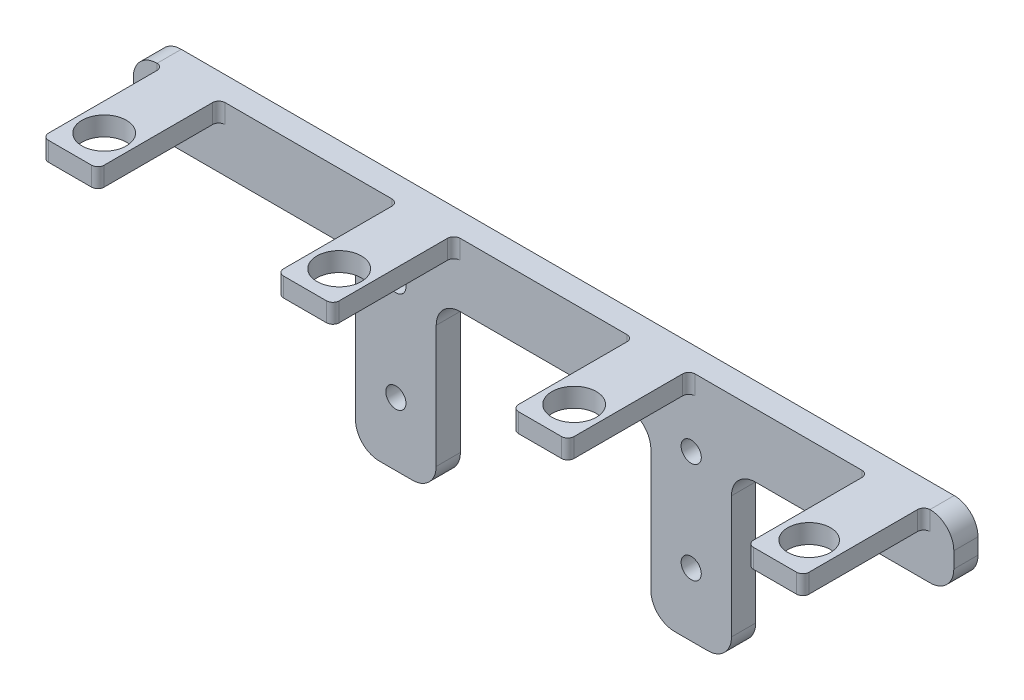
from build123d import *

# Parameters (mm, degrees)
BOSS_EXTRUDE1_DEPTH = 7.62
SKETCH2_R           = 3.17999999
CUT_EXTRUDE1_DEPTH  = 45.72
SKETCH3_W           = 17.5
SKETCH3_H           = 38.105
BOSS_EXTRUDE2_DEPTH = 5.99948
FILLET1_R           = 7.5
SKETCH5_R           = 6.75
SKETCH5_R_2         = 7
CUT_EXTRUDE2_DEPTH  = 10
FILLET2_R           = 2


with BuildPart() as part:
    # Sketch1 → Boss-Extrude1 (new body)
    with BuildSketch(Plane.XY):
        Polygon((-95.4, 59.77), (-95.4, 79.77), (163, 79.77), (163, 59.77), (93, 59.77), (93, 6.27), (67.6, 6.27), (67.6, 59.77), (0, 59.77), (0, 6.27), (-25.4, 6.27), (-25.4, 59.77), align=None)
    extrude(amount=BOSS_EXTRUDE1_DEPTH)

    # Sketch2 → Cut-Extrude1 (cut)
    with BuildSketch(Plane(origin=(0, 0, 0), x_dir=(-1, 0, 0), z_dir=(0, 0, -1))):
        with Locations((-80.3, 57.97)):
            Circle(SKETCH2_R)
        with Locations((-80.3, 26.22)):
            Circle(SKETCH2_R)
        with Locations((12.7, 26.22)):
            Circle(SKETCH2_R)
        with Locations((12.7, 57.97)):
            Circle(SKETCH2_R)
    extrude(amount=-CUT_EXTRUDE1_DEPTH, mode=Mode.SUBTRACT)

    # Sketch3 → Boss-Extrude2 (add)
    with BuildSketch(Plane(origin=(0, 79.77, 0), x_dir=(1, 0, 0), z_dir=(0, 1, 0))):
        with Locations((144.8, -26.6725)):
            Rectangle(SKETCH3_W, SKETCH3_H)
        with Locations((-77.2, -26.6725)):
            Rectangle(SKETCH3_W, SKETCH3_H)
        with Locations((-3.2, -26.6725)):
            Rectangle(SKETCH3_W, SKETCH3_H)
        with Locations((70.8, -26.6725)):
            Rectangle(SKETCH3_W, SKETCH3_H)
    extrude(amount=-BOSS_EXTRUDE2_DEPTH)

    # Fillet1
    fillet1_edges = [part.edges().sort_by_distance(p)[0] for p in [
        (-95.4, 59.77, 3.81),
        (-95.4, 79.77, 3.81),
        (163, 79.77, 3.81),
        (163, 59.77, 3.81),
        (93, 59.77, 3.81),
        (93, 6.27, 3.81),
        (67.6, 6.27, 3.81),
        (67.6, 59.77, 3.81),
        (0, 59.77, 3.81),
        (0, 6.27, 3.81),
        (-25.4, 6.27, 3.81),
        (-25.4, 59.77, 3.81),
    ]]
    fillet(fillet1_edges, radius=FILLET1_R)

    # Sketch5 → Cut-Extrude2 (cut)
    with BuildSketch(Plane(origin=(0, 79.77, 0), x_dir=(1, 0, 0), z_dir=(0, 1, 0))):
        with Locations(Location((144.800446227, -34.97274241, 0), (0, 0, 180))):
            Circle(SKETCH5_R)
        with Locations(Location((70.800446272, -34.975332504, 0), (0, 0, 180))):
            Circle(SKETCH5_R_2)
        with Locations(Location((-3.199553683, -34.977922599, 0), (0, 0, 180))):
            Circle(SKETCH5_R_2)
        with Locations(Location((-77.199553637, -34.980512693, 0), (0, 0, 180))):
            Circle(SKETCH5_R_2)
    extrude(amount=-CUT_EXTRUDE2_DEPTH, mode=Mode.SUBTRACT)

    # Fillet2
    fillet2_edges = [part.edges().sort_by_distance(p)[0] for p in [
        (153.55, 76.77026, 7.62),
        (153.55, 76.77026, 45.725),
        (136.05, 76.77026, 45.725),
        (136.05, 76.77026, 7.62),
        (-85.95, 76.77026, 45.725),
        (-85.95, 76.77026, 7.62),
        (-68.45, 76.77026, 7.62),
        (-68.45, 76.77026, 45.725),
        (5.55, 76.77026, 7.62),
        (5.55, 76.77026, 45.725),
        (-11.95, 76.77026, 45.725),
        (-11.95, 76.77026, 7.62),
        (62.05, 76.77026, 7.62),
        (79.55, 76.77026, 7.62),
        (79.55, 76.77026, 45.725),
        (62.05, 76.77026, 45.725),
    ]]
    fillet(fillet2_edges, radius=FILLET2_R)


solid = part.part
